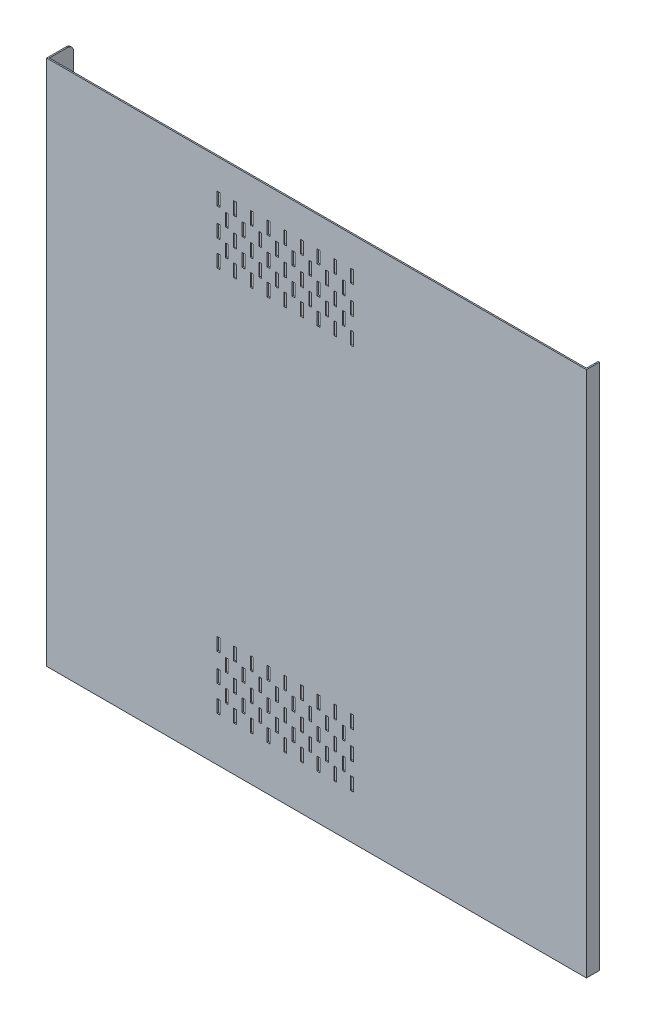
from build123d import *

# Parameters (mm, degrees)
SCHIZZO1_W                   = 420
SCHIZZO1_H                   = 410
ESTRUSIONE_ESTRUSIONE1_DEPTH = 1
SCHIZZO2_W                   = 2.168160731
SCHIZZO2_H                   = 10
TAGLIO_ESTRUSIONE1_DEPTH     = 1
SCHIZZO3_R                   = 2.42119193
ESTRUSIONE_ESTRUSIONE2_DEPTH = 1
SCHIZZO4_W                   = 10
SCHIZZO4_H                   = 410
ESTRUSIONE_ESTRUSIONE3_DEPTH = 1


with BuildPart() as part:
    # Schizzo1 → Estrusione-Estrusione1 (new body)
    with BuildSketch(Plane.XY):
        Rectangle(SCHIZZO1_W, SCHIZZO1_H)
    extrude(amount=ESTRUSIONE_ESTRUSIONE1_DEPTH)

    # Schizzo2 → Taglio-Estrusione1 (cut)
    with BuildSketch(Plane.XY.offset(1)):
        with Locations((-63.423021259, 176.595943529)):
            Rectangle(SCHIZZO2_W, SCHIZZO2_H)
        with Locations((-76.423021259, 176.595943529)):
            Rectangle(SCHIZZO2_W, SCHIZZO2_H)
        with Locations((-50.423021259, 176.595943529)):
            Rectangle(SCHIZZO2_W, SCHIZZO2_H)
        with Locations((-37.423021259, 176.595943529)):
            Rectangle(SCHIZZO2_W, SCHIZZO2_H)
        with Locations((-24.423021259, 176.595943529)):
            Rectangle(SCHIZZO2_W, SCHIZZO2_H)
        with Locations((-11.423021259, 176.595943529)):
            Rectangle(SCHIZZO2_W, SCHIZZO2_H)
        with Locations((1.576978742, 176.595943529)):
            Rectangle(SCHIZZO2_W, SCHIZZO2_H)
        with Locations((14.576978742, 176.595943529)):
            Rectangle(SCHIZZO2_W, SCHIZZO2_H)
        with Locations((27.576978742, 176.595943529)):
            Rectangle(SCHIZZO2_W, SCHIZZO2_H)
        with Locations((-76.423021259, 154.970623818)):
            Rectangle(SCHIZZO2_W, SCHIZZO2_H)
        with Locations((-63.423021259, 154.970623818)):
            Rectangle(SCHIZZO2_W, SCHIZZO2_H)
        with Locations((27.576978742, 154.970623818)):
            Rectangle(SCHIZZO2_W, SCHIZZO2_H)
        with Locations((-11.423021259, 154.970623818)):
            Rectangle(SCHIZZO2_W, SCHIZZO2_H)
        with Locations((-24.423021259, 154.970623818)):
            Rectangle(SCHIZZO2_W, SCHIZZO2_H)
        with Locations((14.576978742, 154.970623818)):
            Rectangle(SCHIZZO2_W, SCHIZZO2_H)
        with Locations((-50.423021259, 154.970623818)):
            Rectangle(SCHIZZO2_W, SCHIZZO2_H)
        with Locations((-37.423021259, 154.970623818)):
            Rectangle(SCHIZZO2_W, SCHIZZO2_H)
        with Locations((1.576978742, 154.970623818)):
            Rectangle(SCHIZZO2_W, SCHIZZO2_H)
        with Locations((-76.423021259, 134.743058998)):
            Rectangle(SCHIZZO2_W, SCHIZZO2_H)
        with Locations((14.576978742, 134.743058998)):
            Rectangle(SCHIZZO2_W, SCHIZZO2_H)
        with Locations((-37.423021259, 134.743058998)):
            Rectangle(SCHIZZO2_W, SCHIZZO2_H)
        with Locations((1.576978742, 134.743058998)):
            Rectangle(SCHIZZO2_W, SCHIZZO2_H)
        with Locations((-63.423021259, 134.743058998)):
            Rectangle(SCHIZZO2_W, SCHIZZO2_H)
        with Locations((-11.423021259, 134.743058998)):
            Rectangle(SCHIZZO2_W, SCHIZZO2_H)
        with Locations((-50.423021259, 134.743058998)):
            Rectangle(SCHIZZO2_W, SCHIZZO2_H)
        with Locations((-24.423021259, 134.743058998)):
            Rectangle(SCHIZZO2_W, SCHIZZO2_H)
        with Locations((27.576978742, 134.743058998)):
            Rectangle(SCHIZZO2_W, SCHIZZO2_H)
        with Locations((-30.902484721, 165.699210631)):
            Rectangle(SCHIZZO2_W, SCHIZZO2_H)
        with Locations((-56.902484721, 165.699210631)):
            Rectangle(SCHIZZO2_W, SCHIZZO2_H)
        with Locations((21.09751528, 165.699210631)):
            Rectangle(SCHIZZO2_W, SCHIZZO2_H)
        with Locations((-4.902484721, 165.699210631)):
            Rectangle(SCHIZZO2_W, SCHIZZO2_H)
        with Locations((-17.902484721, 165.699210631)):
            Rectangle(SCHIZZO2_W, SCHIZZO2_H)
        with Locations((8.097515279, 165.699210631)):
            Rectangle(SCHIZZO2_W, SCHIZZO2_H)
        with Locations((-43.902484721, 165.699210631)):
            Rectangle(SCHIZZO2_W, SCHIZZO2_H)
        with Locations((-69.90248472, 165.699210631)):
            Rectangle(SCHIZZO2_W, SCHIZZO2_H)
        with Locations((-30.902484721, 144.970623818)):
            Rectangle(SCHIZZO2_W, SCHIZZO2_H)
        with Locations((-56.902484721, 144.970623818)):
            Rectangle(SCHIZZO2_W, SCHIZZO2_H)
        with Locations((21.09751528, 144.970623818)):
            Rectangle(SCHIZZO2_W, SCHIZZO2_H)
        with Locations((-43.902484721, 144.970623818)):
            Rectangle(SCHIZZO2_W, SCHIZZO2_H)
        with Locations((-17.902484721, 144.970623818)):
            Rectangle(SCHIZZO2_W, SCHIZZO2_H)
        with Locations((-69.90248472, 144.970623818)):
            Rectangle(SCHIZZO2_W, SCHIZZO2_H)
        with Locations((8.097515279, 144.970623818)):
            Rectangle(SCHIZZO2_W, SCHIZZO2_H)
        with Locations((-4.902484721, 144.970623818)):
            Rectangle(SCHIZZO2_W, SCHIZZO2_H)
        with Locations((-63.423021259, -123.508282326)):
            Rectangle(SCHIZZO2_W, SCHIZZO2_H)
        with Locations((-37.423021259, -123.508282326)):
            Rectangle(SCHIZZO2_W, SCHIZZO2_H)
        with Locations((1.576978742, -145.133602037)):
            Rectangle(SCHIZZO2_W, SCHIZZO2_H)
        with Locations((-50.423021259, -145.133602037)):
            Rectangle(SCHIZZO2_W, SCHIZZO2_H)
        with Locations((1.576978742, -165.361166857)):
            Rectangle(SCHIZZO2_W, SCHIZZO2_H)
        with Locations((-4.902484721, -134.405015224)):
            Rectangle(SCHIZZO2_W, SCHIZZO2_H)
        with Locations((8.097515279, -134.405015224)):
            Rectangle(SCHIZZO2_W, SCHIZZO2_H)
        with Locations((21.09751528, -155.133602037)):
            Rectangle(SCHIZZO2_W, SCHIZZO2_H)
        with Locations((-56.902484721, -155.133602037)):
            Rectangle(SCHIZZO2_W, SCHIZZO2_H)
        with Locations((-76.423021259, -165.361166857)):
            Rectangle(SCHIZZO2_W, SCHIZZO2_H)
        with Locations((-50.423021259, -123.508282326)):
            Rectangle(SCHIZZO2_W, SCHIZZO2_H)
        with Locations((1.576978742, -123.508282326)):
            Rectangle(SCHIZZO2_W, SCHIZZO2_H)
        with Locations((14.576978742, -145.133602037)):
            Rectangle(SCHIZZO2_W, SCHIZZO2_H)
        with Locations((27.576978742, -145.133602037)):
            Rectangle(SCHIZZO2_W, SCHIZZO2_H)
        with Locations((-11.423021259, -165.361166857)):
            Rectangle(SCHIZZO2_W, SCHIZZO2_H)
        with Locations((-43.902484721, -134.405015224)):
            Rectangle(SCHIZZO2_W, SCHIZZO2_H)
        with Locations((-43.902484721, -155.133602037)):
            Rectangle(SCHIZZO2_W, SCHIZZO2_H)
        with Locations((-76.423021259, -145.133602037)):
            Rectangle(SCHIZZO2_W, SCHIZZO2_H)
        with Locations((-37.423021259, -145.133602037)):
            Rectangle(SCHIZZO2_W, SCHIZZO2_H)
        with Locations((27.576978742, -165.361166857)):
            Rectangle(SCHIZZO2_W, SCHIZZO2_H)
        with Locations((-30.902484721, -134.405015224)):
            Rectangle(SCHIZZO2_W, SCHIZZO2_H)
        with Locations((8.097515279, -155.133602037)):
            Rectangle(SCHIZZO2_W, SCHIZZO2_H)
        with Locations((-69.90248472, -155.133602037)):
            Rectangle(SCHIZZO2_W, SCHIZZO2_H)
        with Locations((-24.423021259, -145.133602037)):
            Rectangle(SCHIZZO2_W, SCHIZZO2_H)
        with Locations((-50.423021259, -165.361166857)):
            Rectangle(SCHIZZO2_W, SCHIZZO2_H)
        with Locations((-4.902484721, -155.133602037)):
            Rectangle(SCHIZZO2_W, SCHIZZO2_H)
        with Locations((-76.423021259, -123.508282326)):
            Rectangle(SCHIZZO2_W, SCHIZZO2_H)
        with Locations((-11.423021259, -123.508282326)):
            Rectangle(SCHIZZO2_W, SCHIZZO2_H)
        with Locations((-37.423021259, -165.361166857)):
            Rectangle(SCHIZZO2_W, SCHIZZO2_H)
        with Locations((-63.423021259, -165.361166857)):
            Rectangle(SCHIZZO2_W, SCHIZZO2_H)
        with Locations((-56.902484721, -134.405015224)):
            Rectangle(SCHIZZO2_W, SCHIZZO2_H)
        with Locations((-30.902484721, -155.133602037)):
            Rectangle(SCHIZZO2_W, SCHIZZO2_H)
        with Locations((14.576978742, -165.361166857)):
            Rectangle(SCHIZZO2_W, SCHIZZO2_H)
        with Locations((-17.902484721, -134.405015224)):
            Rectangle(SCHIZZO2_W, SCHIZZO2_H)
        with Locations((-69.90248472, -134.405015224)):
            Rectangle(SCHIZZO2_W, SCHIZZO2_H)
        with Locations((-24.423021259, -123.508282326)):
            Rectangle(SCHIZZO2_W, SCHIZZO2_H)
        with Locations((27.576978742, -123.508282326)):
            Rectangle(SCHIZZO2_W, SCHIZZO2_H)
        with Locations((-24.423021259, -165.361166857)):
            Rectangle(SCHIZZO2_W, SCHIZZO2_H)
        with Locations((-17.902484721, -155.133602037)):
            Rectangle(SCHIZZO2_W, SCHIZZO2_H)
        with Locations((14.576978742, -123.508282326)):
            Rectangle(SCHIZZO2_W, SCHIZZO2_H)
        with Locations((21.09751528, -134.405015224)):
            Rectangle(SCHIZZO2_W, SCHIZZO2_H)
        with Locations((-63.423021259, -145.133602037)):
            Rectangle(SCHIZZO2_W, SCHIZZO2_H)
        with Locations((-11.423021259, -145.133602037)):
            Rectangle(SCHIZZO2_W, SCHIZZO2_H)
    extrude(amount=-TAGLIO_ESTRUSIONE1_DEPTH, mode=Mode.SUBTRACT)

    # Schizzo3 → Estrusione-Estrusione2 (add)
    with BuildSketch(Plane.ZY.offset(210)):
        with BuildLine():
            Line((1, 205), (-14, 205))
            ThreePointArc((-14, 205), (-17.535533906, 203.535533906), (-19, 200))
            Line((-19, 200), (-19, 180))
            ThreePointArc((-19, 180), (-17.535533906, 176.464466094), (-14, 175))
            Line((-14, 175), (-8, 175))
            Line((-8, 175), (-8, -205))
            Line((-8, -205), (1, -205))
            Line((1, -205), (1, 205))
        make_face()
        with Locations((-14, 180)):
            Circle(SCHIZZO3_R, mode=Mode.SUBTRACT)
    extrude(amount=-ESTRUSIONE_ESTRUSIONE2_DEPTH)

    # Schizzo4 → Estrusione-Estrusione3 (add)
    with BuildSketch(Plane(origin=(210, 0, 0), x_dir=(0, 0, -1), z_dir=(1, 0, 0))):
        with Locations((4, 0)):
            Rectangle(SCHIZZO4_W, SCHIZZO4_H)
    extrude(amount=-ESTRUSIONE_ESTRUSIONE3_DEPTH)


solid = part.part
